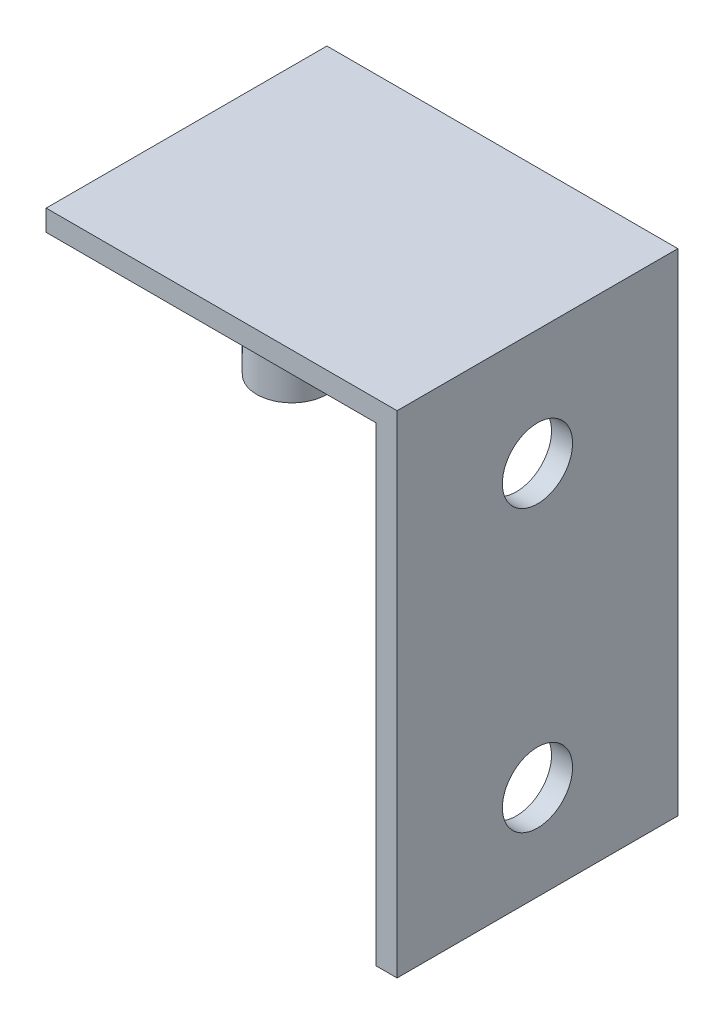
from build123d import *

# Parameters (mm, degrees)
SUPERFICIE_EXTRUIR1_1_DEPTH = 40
DAR_ESPESOR1_T1             = 3
CROQUIS2_R                  = 5
EXTRUIR1_DEPTH              = 23
CROQUIS3_R                  = 5
EXTRUIR2_DEPTH              = 20


with BuildPart() as body_1:
    # Superficie-Extruir1: a surface, the sketch's curves swept straight by 40 mm
    with BuildLine(Plane.XY, mode=Mode.PRIVATE) as superficie_extruir1_1_path:
        Line((0, -70), (0, 0))
        Line((0, 0), (-50, 0))
    superficie_extruir1_1 = Shell.extrude(superficie_extruir1_1_path.wire(), (0 * SUPERFICIE_EXTRUIR1_1_DEPTH, 0 * SUPERFICIE_EXTRUIR1_1_DEPTH, 1 * SUPERFICIE_EXTRUIR1_1_DEPTH))
    add(Solid.thicken(superficie_extruir1_1, DAR_ESPESOR1_T1))

    # Croquis2 → Extruir1 (add)
    with BuildSketch(Plane(origin=(0, 0, 0), x_dir=(1, 0, 0), z_dir=(0, 1, 0))):
        with Locations(Location((-35, -20, 0), (0, 0, 180))):
            Circle(CROQUIS2_R)
    extrude(amount=-EXTRUIR1_DEPTH)

    # Croquis3 → Extruir2 (cut)
    with BuildSketch(Plane.ZY.offset(3)):
        with Locations(Location((20, -56.5, 0), (0, 0, 270))):
            Circle(CROQUIS3_R)
        with Locations(Location((20, -16.5, 0), (0, 0, 90))):
            Circle(CROQUIS3_R)
    extrude(amount=-EXTRUIR2_DEPTH, mode=Mode.SUBTRACT)


solid = body_1.part
